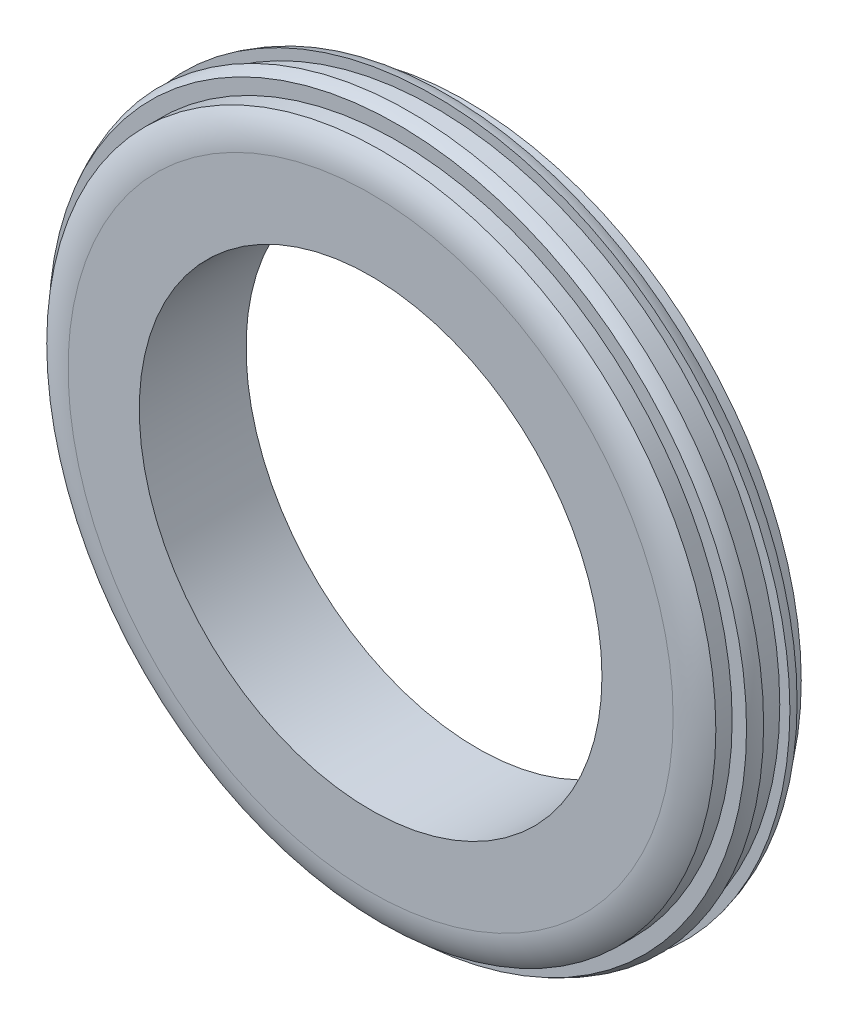
from build123d import *

# Parameters (mm, degrees)
SKETCH3_W   = 14.319236131
SKETCH3_H   = 126.612193163
SKETCH3_W_2 = 30.145760277
SKETCH3_H_2 = 185.396425703
SKETCH3_W_3 = 12.058304111
SKETCH3_H_3 = 222.324982043


with BuildPart() as part:
    # Sketch2 → Revolve1 (revolve)
    with BuildSketch(Plane(origin=(0, 0, 0), x_dir=(0, 0, -1), z_dir=(1, 0, 0)), mode=Mode.PRIVATE) as revolve1_sk:
        with BuildLine():
            Line((-33.902439024, 170), (-33.902439024, 130))
            Line((-33.902439024, 130), (26.097560976, 130))
            Line((26.097560976, 130), (26.097560976, 170))
            ThreePointArc((26.097560976, 170), (-3.902439024, 200), (-33.902439024, 170))
        make_face()
    revolve(revolve1_sk.sketch.rotate(Axis((0, 0, 102.578397213), (0, 0, -1)), 90), axis=Axis((0, 0, 102.578397213), (0, 0, -1)))

    # Sketch3 → Cut-Revolve1 (revolve, cut)
    with BuildSketch(Plane(origin=(0, 0, 0), x_dir=(0, 0, -1), z_dir=(1, 0, 0)), mode=Mode.PRIVATE) as cut_revolve1_sk:
        with Locations((-4.789385206, 256.956129248)):
            Rectangle(SKETCH3_W, SKETCH3_H)
        with Locations((-33.804679472, 280.695915466)):
            Rectangle(SKETCH3_W_2, SKETCH3_H_2)
        with Locations((14.428536971, 299.160193636)):
            Rectangle(SKETCH3_W_3, SKETCH3_H_3)
    revolve(cut_revolve1_sk.sketch.rotate(Axis((0, 0, 101.363868033), (0, 0, -1)), 90), axis=Axis((0, 0, 101.363868033), (0, 0, -1)), mode=Mode.SUBTRACT)


solid = part.part
